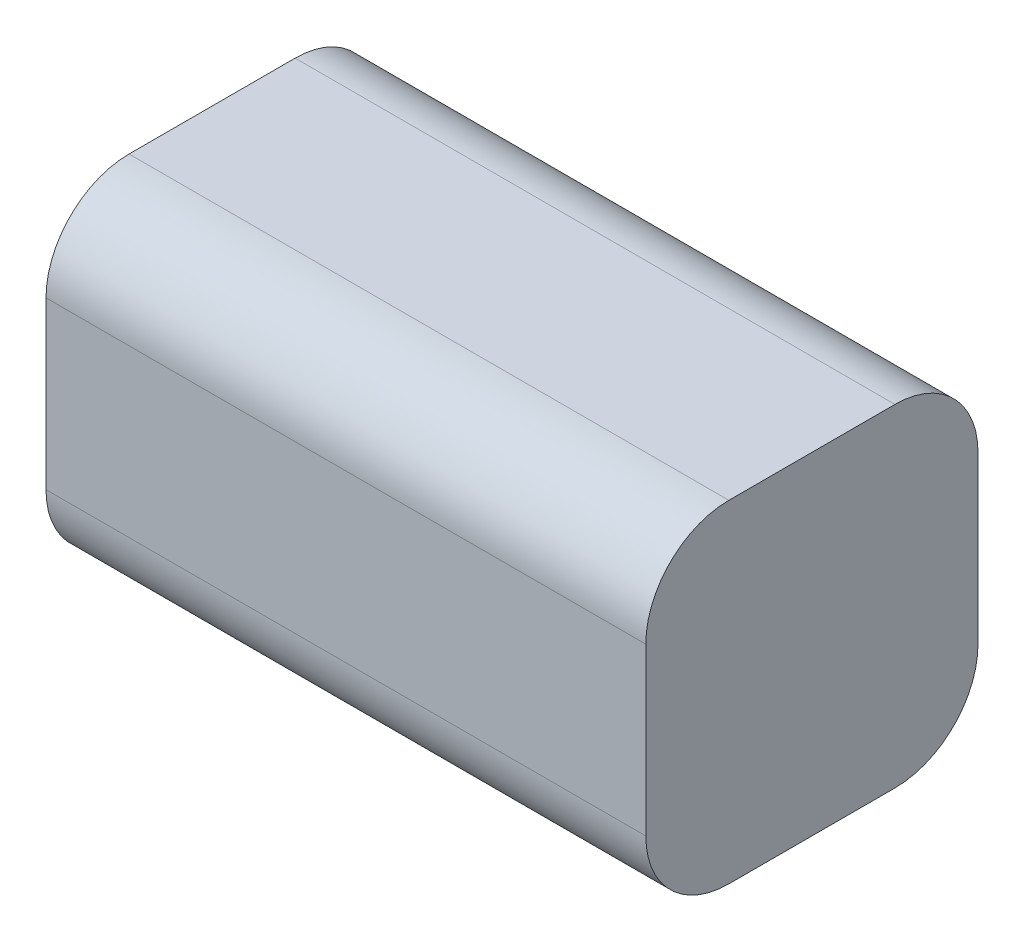
from build123d import *

# Parameters (mm, degrees)
SKETCH1_W           = 65
SKETCH1_H           = 36
BOSS_EXTRUDE1_DEPTH = 18
FILLET1_R           = 9


with BuildPart() as part:
    # Sketch1 → Boss-Extrude1 (new, symmetric)
    with BuildSketch(Plane(origin=(0, 0, 0), x_dir=(1, 0, 0), z_dir=(0, 1, 0))):
        Rectangle(SKETCH1_W, SKETCH1_H)
    extrude(amount=BOSS_EXTRUDE1_DEPTH, both=True)

    # Fillet1
    fillet1_edges = [part.edges().sort_by_distance(p)[0] for p in [
        (0, 18, 18),
        (0, -18, 18),
        (0, -18, -18),
        (0, 18, -18),
    ]]
    fillet(fillet1_edges, radius=FILLET1_R)


solid = part.part
